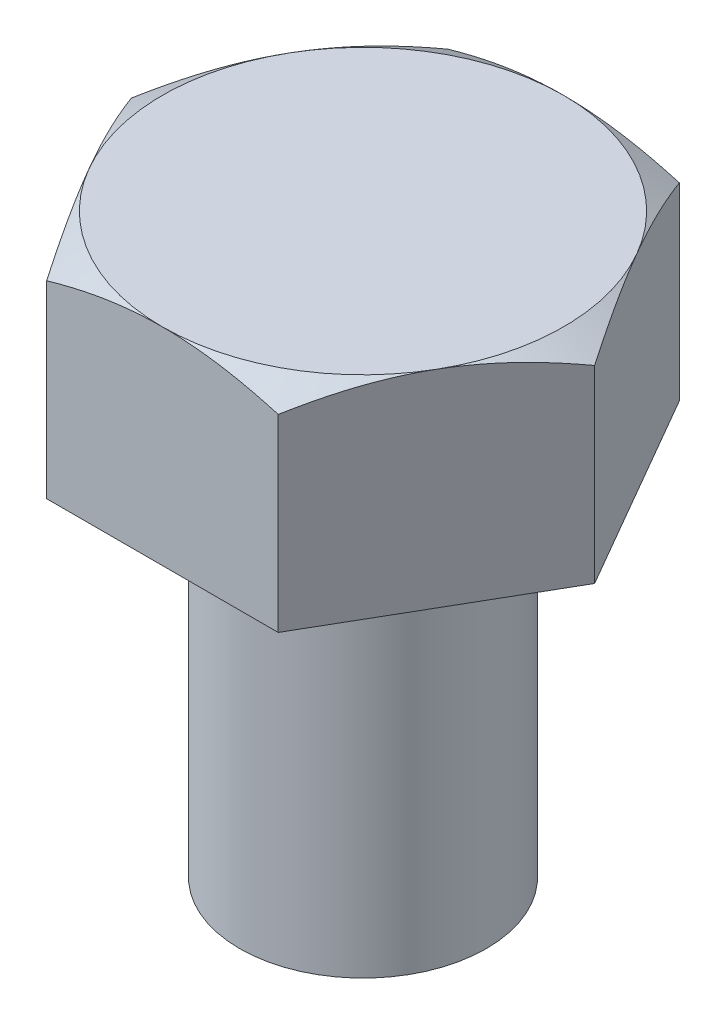
from build123d import *

# Parameters (mm, degrees)
BOSS_EXTRUDE1_DEPTH = 6.7
SKETCH2_R           = 4
BOSS_EXTRUDE2_DEPTH = 12
SKETCH3_OUTSIDE_W   = 57.108
SKETCH3_OUTSIDE_H   = 55.096
SKETCH3_OUTSIDE_R   = 6.5
CUT_EXTRUDE3_DEPTH  = 10
CUT_EXTRUDE3_DRAFT  = -60


with BuildPart() as part:
    # Sketch1 → Boss-Extrude1 (new body)
    with BuildSketch(Plane(origin=(0, 0, 0), x_dir=(1, 0, 0), z_dir=(0, 1, 0))):
        Polygon((7.505553499, 0), (3.75277675, 6.5), (-3.75277675, 6.5), (-7.505553499, 0), (-3.75277675, -6.5), (3.75277675, -6.5), align=None)
    extrude(amount=BOSS_EXTRUDE1_DEPTH)

    # Sketch2 → Boss-Extrude2 (add)
    with BuildSketch(Plane.XZ):
        with Locations(Location((0, 0, 0), (0, 0, 270))):
            Circle(SKETCH2_R)
    extrude(amount=BOSS_EXTRUDE2_DEPTH)


with BuildPart() as cut_extrude3_tool:
    # Sketch3 outside → Cut-Extrude3 (with draft: the straight prism first)
    with BuildSketch(Plane(origin=(0, 6.7, 0), x_dir=(1, 0, 0), z_dir=(0, 1, 0))):
        Rectangle(SKETCH3_OUTSIDE_W, SKETCH3_OUTSIDE_H)
        Circle(SKETCH3_OUTSIDE_R, mode=Mode.SUBTRACT)
    extrude(amount=-CUT_EXTRUDE3_DEPTH)
    # Cut-Extrude3: the draft: its side faces are tilted about the plane it starts from
    cut_extrude3_sides = [cut_extrude3_tool.faces().sort_by_distance(p)[0] for p in [
        (0, 1.7, 27.548),
        (28.554, 1.7, 0),
        (0, 1.7, -27.548),
        (-28.554, 1.7, 0),
        (-6.5, 1.7, 0),
    ]]
    draft(cut_extrude3_sides, Plane(origin=(0, 6.7, 0), x_dir=(1, 0, 0), z_dir=(0, 1, 0)), CUT_EXTRUDE3_DRAFT)


with BuildPart() as part_1:
    add(part.part)

    # Cut-Extrude3: cut by cut_extrude3_tool
    add(cut_extrude3_tool.part, mode=Mode.SUBTRACT)


solid = part_1.part
